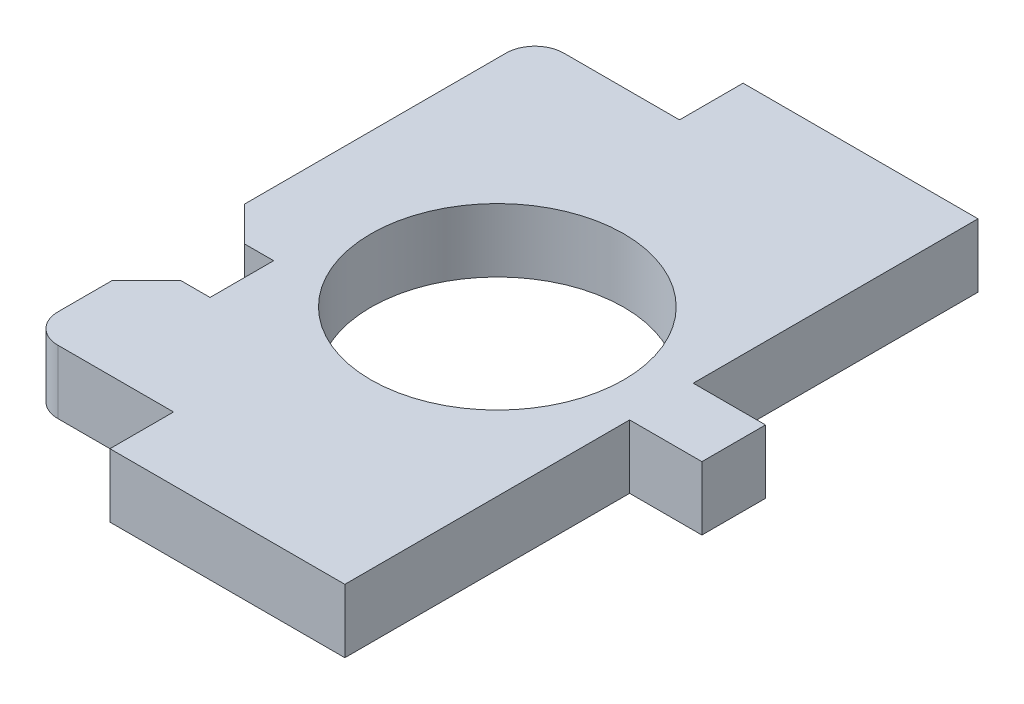
from build123d import *

# Parameters (mm, degrees)
BOSS_EXTRUDE1_DEPTH = 2.794
SKETCH2_W           = 6.35
SKETCH2_H           = 5.588
BOSS_EXTRUDE2_DEPTH = 2.794
SKETCH4_R           = 11.1125
CUT_EXTRUDE2_DEPTH  = 35.803228508
FILLET1_R           = 2.54


with BuildPart() as part:
    # Sketch1 → Boss-Extrude1 (new, symmetric)
    with BuildSketch(Plane(origin=(0, 0, 0), x_dir=(1, 0, 0), z_dir=(0, 1, 0))):
        Polygon((-13.81125, 22.225), (-19.52625, 22.225), (-19.52625, -3.27025), (-16.47825, -6.31825), (-13.93825, -6.31825), (-13.93825, -11.90625), (-16.47825, -11.90625), (-19.52625, -14.95425), (-19.52625, -22.225), (-13.81125, -22.225), (-6.82625, -22.225), (-6.82625, -27.813), (13.81125, -27.813), (13.81125, -22.225), (13.81125, 22.225), (13.81125, 27.813), (-6.82625, 27.813), (-6.82625, 22.225), align=None)
    extrude(amount=BOSS_EXTRUDE1_DEPTH, both=True)

    # Sketch2 → Boss-Extrude2 (add, symmetric)
    with BuildSketch(Plane(origin=(0, 0, 0), x_dir=(1, 0, 0), z_dir=(0, 1, 0))):
        with Locations((16.98625, 0)):
            Rectangle(SKETCH2_W, SKETCH2_H)
    extrude(amount=BOSS_EXTRUDE2_DEPTH, both=True)

    # Sketch4 → Cut-Extrude2 (cut, through all)
    with BuildSketch(Plane(origin=(0, 2.794, 0), x_dir=(1, 0, 0), z_dir=(0, 1, 0))):
        with Locations(Location((-0.604747552, 0, 0), (0, 0, 270))):
            Circle(SKETCH4_R)
    extrude(amount=-CUT_EXTRUDE2_DEPTH, mode=Mode.SUBTRACT)

    # Fillet1
    fillet1_edges = [part.edges().sort_by_distance(p)[0] for p in [
        (-19.52625, 0, 22.225),
        (-19.52625, 0, -22.225),
    ]]
    fillet(fillet1_edges, radius=FILLET1_R)


solid = part.part
